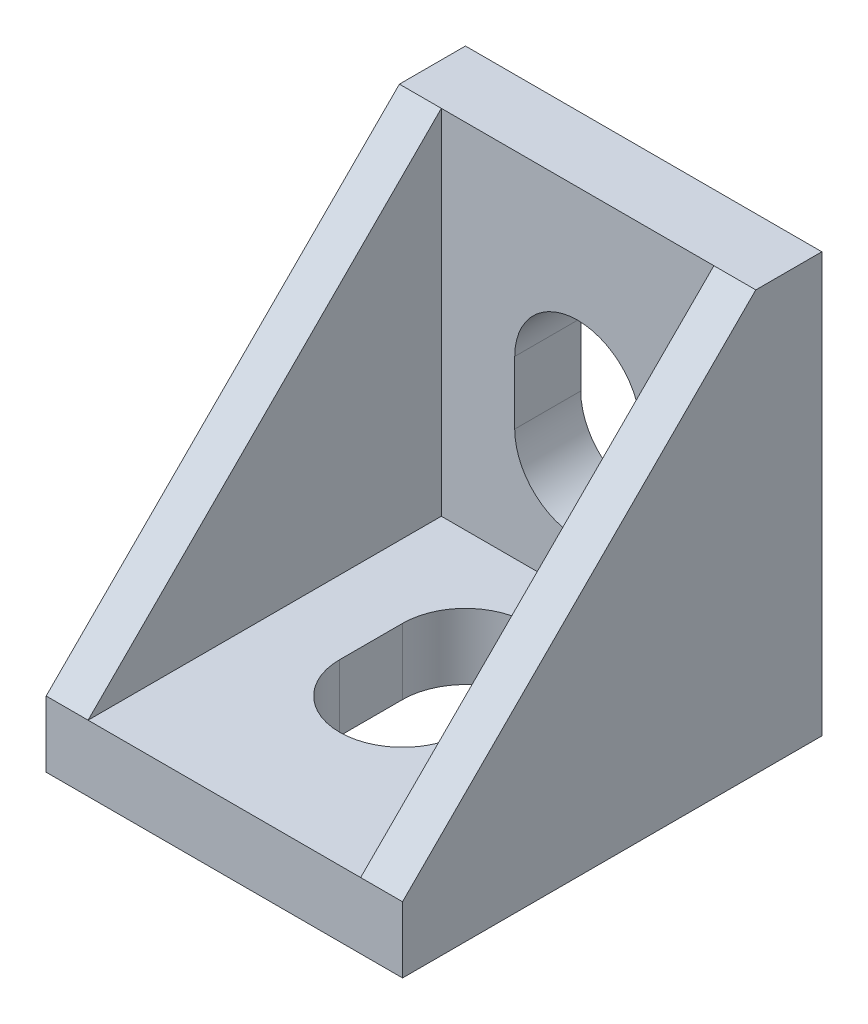
from build123d import *

# Parameters (mm, degrees)
SKETCH1_W           = 17
SKETCH1_H           = 20
BOSS_EXTRUDE1_DEPTH = 3.15
SKETCH2_W           = 17
SKETCH2_H           = 3.15
BOSS_EXTRUDE2_DEPTH = 16.85
CUT_EXTRUDE1_REACH  = 25.922
SKETCH3_R           = 3
CUT_EXTRUDE2_REACH  = 31.534
SKETCH4_R           = 3
SKETCH4_W           = 6
SKETCH4_H           = 3
BOSS_EXTRUDE3_DEPTH = 2
BOSS_EXTRUDE4_DEPTH = 2


with BuildPart() as part:
    # Sketch1 → Boss-Extrude1 (new body)
    with BuildSketch(Plane(origin=(0, 0, 0), x_dir=(1, 0, 0), z_dir=(0, 1, 0))):
        Rectangle(SKETCH1_W, SKETCH1_H)
    extrude(amount=BOSS_EXTRUDE1_DEPTH)

    # Sketch2 → Boss-Extrude2 (add)
    with BuildSketch(Plane(origin=(0, 3.15, 0), x_dir=(1, 0, 0), z_dir=(0, 1, 0))):
        with Locations((0, 8.425)):
            Rectangle(SKETCH2_W, SKETCH2_H)
    extrude(amount=BOSS_EXTRUDE2_DEPTH)

    # Sketch3 → Cut-Extrude1 (cut, up to next)
    with BuildSketch(Plane.XZ, mode=Mode.PRIVATE) as cut_extrude1_sk1:
        with BuildLine():
            ThreePointArc((-3, -1.5), (0, -4.5), (3, -1.5))
            Line((3, -1.5), (0, -1.5))
            Line((0, -1.5), (-3, -1.5))
        make_face()
    cut_extrude1_tool1 = extrude(cut_extrude1_sk1.sketch, amount=-CUT_EXTRUDE1_REACH, mode=Mode.PRIVATE) & part.part
    # Sketch3 → Cut-Extrude1 (cut, up to next)
    with BuildSketch(Plane.XZ, mode=Mode.PRIVATE) as cut_extrude1_sk2:
        with Locations((0, 1.5)):
            Circle(SKETCH3_R)
    cut_extrude1_tool2 = extrude(cut_extrude1_sk2.sketch, amount=-CUT_EXTRUDE1_REACH, mode=Mode.PRIVATE) & part.part
    # Sketch3 → Cut-Extrude1 (cut, up to next)
    with BuildSketch(Plane.XZ, mode=Mode.PRIVATE) as cut_extrude1_sk3:
        with Locations((0, -1.5)):
            Circle(SKETCH3_R)
    cut_extrude1_tool3 = extrude(cut_extrude1_sk3.sketch, amount=-CUT_EXTRUDE1_REACH, mode=Mode.PRIVATE) & part.part
    # Sketch3 → Cut-Extrude1 (cut, up to next)
    with BuildSketch(Plane.XZ, mode=Mode.PRIVATE) as cut_extrude1_sk4:
        with BuildLine():
            Line((0, -1.5), (3, -1.5))
            ThreePointArc((3, -1.5), (2.897777479, -0.723542865), (2.598076211, 0))
            ThreePointArc((2.598076211, 0), (1.5, -1.098076211), (0, -1.5))
        make_face()
    cut_extrude1_tool4 = extrude(cut_extrude1_sk4.sketch, amount=-CUT_EXTRUDE1_REACH, mode=Mode.PRIVATE) & part.part
    # Sketch3 → Cut-Extrude1 (cut, up to next)
    with BuildSketch(Plane.XZ, mode=Mode.PRIVATE) as cut_extrude1_sk5:
        with BuildLine():
            ThreePointArc((0, -1.5), (-1.5, -1.098076211), (-2.598076211, 0))
            ThreePointArc((-2.598076211, 0), (-2.897777479, -0.723542865), (-3, -1.5))
            Line((-3, -1.5), (0, -1.5))
        make_face()
    cut_extrude1_tool5 = extrude(cut_extrude1_sk5.sketch, amount=-CUT_EXTRUDE1_REACH, mode=Mode.PRIVATE) & part.part
    # Sketch3 → Cut-Extrude1 (cut, up to next)
    with BuildSketch(Plane.XZ, mode=Mode.PRIVATE) as cut_extrude1_sk6:
        with BuildLine():
            ThreePointArc((2.598076211, 0), (2.897777479, 0.723542865), (3, 1.5))
            Line((3, 1.5), (0, 1.5))
            ThreePointArc((0, 1.5), (1.5, 1.098076211), (2.598076211, 0))
        make_face()
    cut_extrude1_tool6 = extrude(cut_extrude1_sk6.sketch, amount=-CUT_EXTRUDE1_REACH, mode=Mode.PRIVATE) & part.part
    # Sketch3 → Cut-Extrude1 (cut, up to next)
    with BuildSketch(Plane.XZ, mode=Mode.PRIVATE) as cut_extrude1_sk7:
        with BuildLine():
            ThreePointArc((-2.598076211, 0), (-1.5, 1.098076211), (0, 1.5))
            Line((0, 1.5), (-3, 1.5))
            ThreePointArc((-3, 1.5), (-2.897777479, 0.723542865), (-2.598076211, 0))
        make_face()
    cut_extrude1_tool7 = extrude(cut_extrude1_sk7.sketch, amount=-CUT_EXTRUDE1_REACH, mode=Mode.PRIVATE) & part.part
    # Sketch3 → Cut-Extrude1 (cut, up to next)
    with BuildSketch(Plane.XZ, mode=Mode.PRIVATE) as cut_extrude1_sk8:
        with BuildLine():
            Line((3, -1.5), (3, 1.5))
            ThreePointArc((3, 1.5), (2.897777479, 0.723542865), (2.598076211, 0))
            ThreePointArc((2.598076211, 0), (2.897777479, -0.723542865), (3, -1.5))
        make_face()
    cut_extrude1_tool8 = extrude(cut_extrude1_sk8.sketch, amount=-CUT_EXTRUDE1_REACH, mode=Mode.PRIVATE) & part.part
    # Sketch3 → Cut-Extrude1 (cut, up to next)
    with BuildSketch(Plane.XZ, mode=Mode.PRIVATE) as cut_extrude1_sk9:
        with BuildLine():
            Line((0, 1.5), (3, 1.5))
            ThreePointArc((3, 1.5), (0, 4.5), (-3, 1.5))
            Line((-3, 1.5), (0, 1.5))
        make_face()
    cut_extrude1_tool9 = extrude(cut_extrude1_sk9.sketch, amount=-CUT_EXTRUDE1_REACH, mode=Mode.PRIVATE) & part.part
    # Sketch3 → Cut-Extrude1 (cut, up to next)
    with BuildSketch(Plane.XZ, mode=Mode.PRIVATE) as cut_extrude1_sk10:
        with BuildLine():
            Line((0, -1.5), (3, -1.5))
            ThreePointArc((3, -1.5), (2.897777479, -0.723542865), (2.598076211, 0))
            ThreePointArc((2.598076211, 0), (1.5, -1.098076211), (0, -1.5))
        make_face()
    cut_extrude1_tool10 = extrude(cut_extrude1_sk10.sketch, amount=-CUT_EXTRUDE1_REACH, mode=Mode.PRIVATE) & part.part
    # Sketch3 → Cut-Extrude1 (cut, up to next)
    with BuildSketch(Plane.XZ, mode=Mode.PRIVATE) as cut_extrude1_sk11:
        with BuildLine():
            ThreePointArc((0, -1.5), (-1.5, -1.098076211), (-2.598076211, 0))
            ThreePointArc((-2.598076211, 0), (-2.897777479, -0.723542865), (-3, -1.5))
            Line((-3, -1.5), (0, -1.5))
        make_face()
    cut_extrude1_tool11 = extrude(cut_extrude1_sk11.sketch, amount=-CUT_EXTRUDE1_REACH, mode=Mode.PRIVATE) & part.part
    # Sketch3 → Cut-Extrude1 (cut, up to next)
    with BuildSketch(Plane.XZ, mode=Mode.PRIVATE) as cut_extrude1_sk12:
        with BuildLine():
            ThreePointArc((-2.598076211, 0), (-2.897777479, 0.723542865), (-3, 1.5))
            Line((-3, 1.5), (-3, -1.5))
            ThreePointArc((-3, -1.5), (-2.897777479, -0.723542865), (-2.598076211, 0))
        make_face()
    cut_extrude1_tool12 = extrude(cut_extrude1_sk12.sketch, amount=-CUT_EXTRUDE1_REACH, mode=Mode.PRIVATE) & part.part
    # Sketch3 → Cut-Extrude1 (cut, up to next)
    with BuildSketch(Plane.XZ, mode=Mode.PRIVATE) as cut_extrude1_sk13:
        with BuildLine():
            ThreePointArc((2.598076211, 0), (2.897777479, 0.723542865), (3, 1.5))
            Line((3, 1.5), (0, 1.5))
            ThreePointArc((0, 1.5), (1.5, 1.098076211), (2.598076211, 0))
        make_face()
    cut_extrude1_tool13 = extrude(cut_extrude1_sk13.sketch, amount=-CUT_EXTRUDE1_REACH, mode=Mode.PRIVATE) & part.part
    # Sketch3 → Cut-Extrude1 (cut, up to next)
    with BuildSketch(Plane.XZ, mode=Mode.PRIVATE) as cut_extrude1_sk14:
        with BuildLine():
            ThreePointArc((-2.598076211, 0), (-1.5, 1.098076211), (0, 1.5))
            Line((0, 1.5), (-3, 1.5))
            ThreePointArc((-3, 1.5), (-2.897777479, 0.723542865), (-2.598076211, 0))
        make_face()
    cut_extrude1_tool14 = extrude(cut_extrude1_sk14.sketch, amount=-CUT_EXTRUDE1_REACH, mode=Mode.PRIVATE) & part.part
    add(cut_extrude1_tool1.solids().sort_by_distance((0, 0, -2.77324))[0], mode=Mode.SUBTRACT)
    add(cut_extrude1_tool2.solids().sort_by_distance((0, 0, 1.5))[0], mode=Mode.SUBTRACT)
    add(cut_extrude1_tool3.solids().sort_by_distance((0, 0, -1.5))[0], mode=Mode.SUBTRACT)
    add(cut_extrude1_tool4.solids().sort_by_distance((2.19025, 0, -1.040207))[0], mode=Mode.SUBTRACT)
    add(cut_extrude1_tool5.solids().sort_by_distance((-2.19025, 0, -1.040207))[0], mode=Mode.SUBTRACT)
    add(cut_extrude1_tool6.solids().sort_by_distance((2.19025, 0, 1.040207))[0], mode=Mode.SUBTRACT)
    add(cut_extrude1_tool7.solids().sort_by_distance((-2.19025, 0, 1.040207))[0], mode=Mode.SUBTRACT)
    add(cut_extrude1_tool8.solids().sort_by_distance((2.880946, 0, 0))[0], mode=Mode.SUBTRACT)
    add(cut_extrude1_tool9.solids().sort_by_distance((0, 0, 2.77324))[0], mode=Mode.SUBTRACT)
    add(cut_extrude1_tool10.solids().sort_by_distance((2.19025, 0, -1.040207))[0], mode=Mode.SUBTRACT)
    add(cut_extrude1_tool11.solids().sort_by_distance((-2.19025, 0, -1.040207))[0], mode=Mode.SUBTRACT)
    add(cut_extrude1_tool12.solids().sort_by_distance((-2.880946, 0, 0))[0], mode=Mode.SUBTRACT)
    add(cut_extrude1_tool13.solids().sort_by_distance((2.19025, 0, 1.040207))[0], mode=Mode.SUBTRACT)
    add(cut_extrude1_tool14.solids().sort_by_distance((-2.19025, 0, 1.040207))[0], mode=Mode.SUBTRACT)

    # Sketch4 → Cut-Extrude2 (cut, up to next)
    with BuildSketch(Plane(origin=(0, 0, -10), x_dir=(-1, 0, 0), z_dir=(0, 0, -1)), mode=Mode.PRIVATE) as cut_extrude2_sk1:
        with Locations((0, 8.5)):
            Circle(SKETCH4_R)
    cut_extrude2_tool1 = extrude(cut_extrude2_sk1.sketch, amount=-CUT_EXTRUDE2_REACH, mode=Mode.PRIVATE) & part.part
    # Sketch4 → Cut-Extrude2 (cut, up to next)
    with BuildSketch(Plane(origin=(0, 0, -10), x_dir=(-1, 0, 0), z_dir=(0, 0, -1)), mode=Mode.PRIVATE) as cut_extrude2_sk2:
        with Locations((0, 11.5)):
            Circle(SKETCH4_R)
    cut_extrude2_tool2 = extrude(cut_extrude2_sk2.sketch, amount=-CUT_EXTRUDE2_REACH, mode=Mode.PRIVATE) & part.part
    # Sketch4 → Cut-Extrude2 (cut, up to next)
    with BuildSketch(Plane(origin=(0, 0, -10), x_dir=(-1, 0, 0), z_dir=(0, 0, -1)), mode=Mode.PRIVATE) as cut_extrude2_sk3:
        with Locations((0, 10)):
            Rectangle(SKETCH4_W, SKETCH4_H)
    cut_extrude2_tool3 = extrude(cut_extrude2_sk3.sketch, amount=-CUT_EXTRUDE2_REACH, mode=Mode.PRIVATE) & part.part
    add(cut_extrude2_tool1.solids().sort_by_distance((0, 8.5, -10))[0], mode=Mode.SUBTRACT)
    add(cut_extrude2_tool2.solids().sort_by_distance((0, 11.5, -10))[0], mode=Mode.SUBTRACT)
    add(cut_extrude2_tool3.solids().sort_by_distance((0, 10, -10))[0], mode=Mode.SUBTRACT)

    # Sketch5 → Boss-Extrude3 (add)
    with BuildSketch(Plane(origin=(8.5, 0, 0), x_dir=(0, 0, -1), z_dir=(1, 0, 0))):
        Polygon((6.85, 20), (-10, 3.15), (6.85, 3.15), align=None)
    extrude(amount=-BOSS_EXTRUDE3_DEPTH)

    # Sketch6 → Boss-Extrude4 (add)
    with BuildSketch(Plane.ZY.offset(8.5)):
        Polygon((10, 3.15), (-6.85, 20), (-6.85, 3.15), align=None)
    extrude(amount=-BOSS_EXTRUDE4_DEPTH)


solid = part.part
